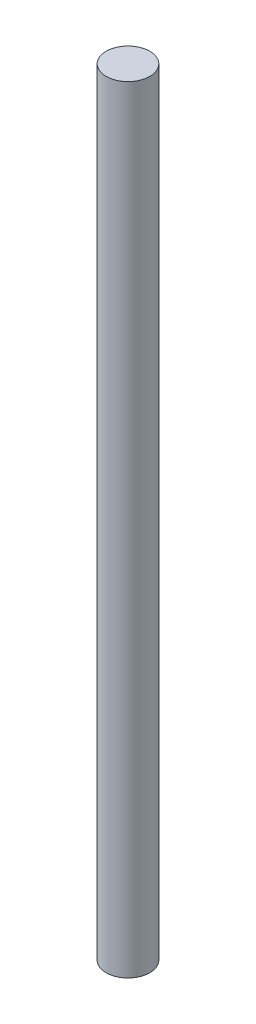
from build123d import *

# Parameters (mm, degrees)
SKETCH1_R           = 5.62
BOSS_EXTRUDE1_DEPTH = 200


with BuildPart() as part:
    # Sketch1 → Boss-Extrude1 (new body)
    with BuildSketch(Plane(origin=(0, 0, 0), x_dir=(1, 0, 0), z_dir=(0, 1, 0))):
        with Locations(Location((0, 0, 0), (0, 0, 270))):
            Circle(SKETCH1_R)
    extrude(amount=BOSS_EXTRUDE1_DEPTH)


solid = part.part
